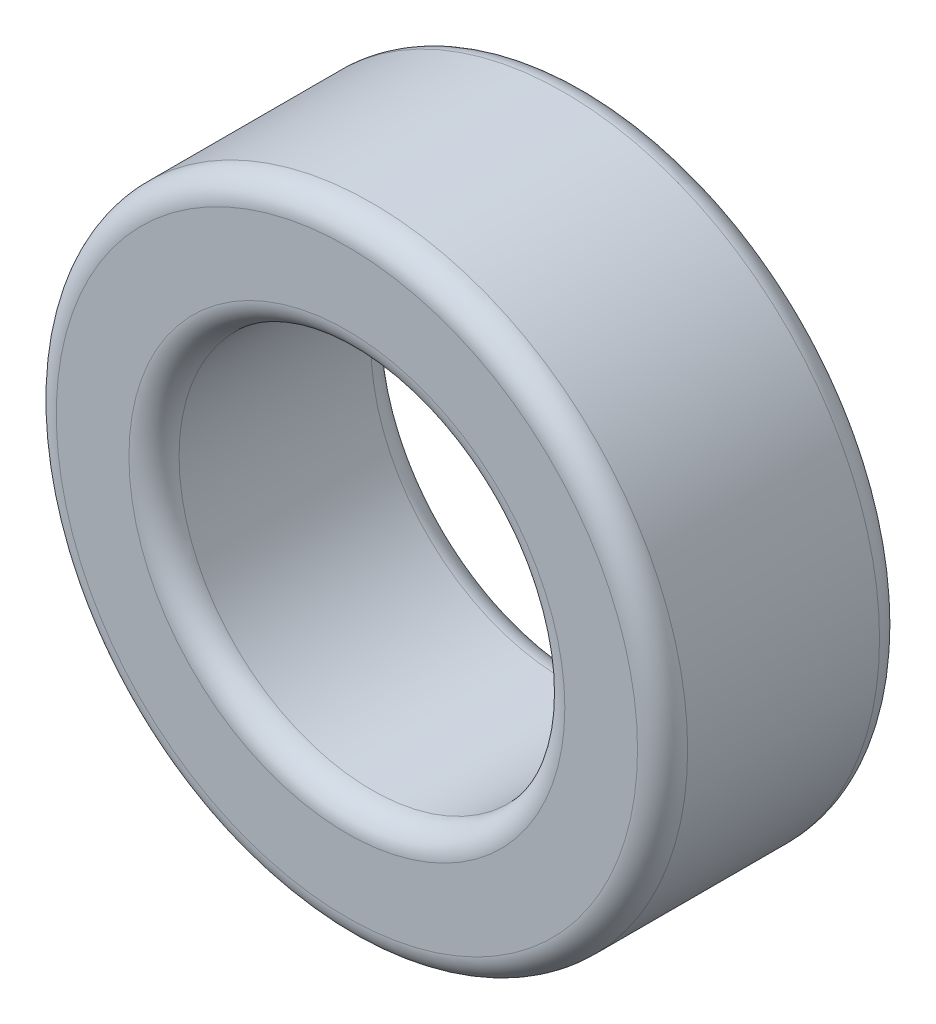
from build123d import *

# Parameters (mm, degrees)
SKETCH_1_R      = 6.3
SKETCH_1_R_2    = 3.85
EXTRUDE_1_DEPTH = 4.83
FILLET_1_R      = 0.5


with BuildPart() as part:
    # Эскиз1 → Бобышка-Вытянуть1 (new body)
    with BuildSketch(Plane.XY):
        Circle(SKETCH_1_R)
        Circle(SKETCH_1_R_2, mode=Mode.SUBTRACT)
    extrude(amount=EXTRUDE_1_DEPTH)

    # Скругление1
    fillet_1_edges = [part.edges().sort_by_distance(p)[0] for p in [
        (-6.3, 0, 0),
        (-6.3, 0, 4.83),
        (-3.85, 0, 0),
        (-3.85, 0, 4.83),
    ]]
    fillet(fillet_1_edges, radius=FILLET_1_R)


solid = part.part
